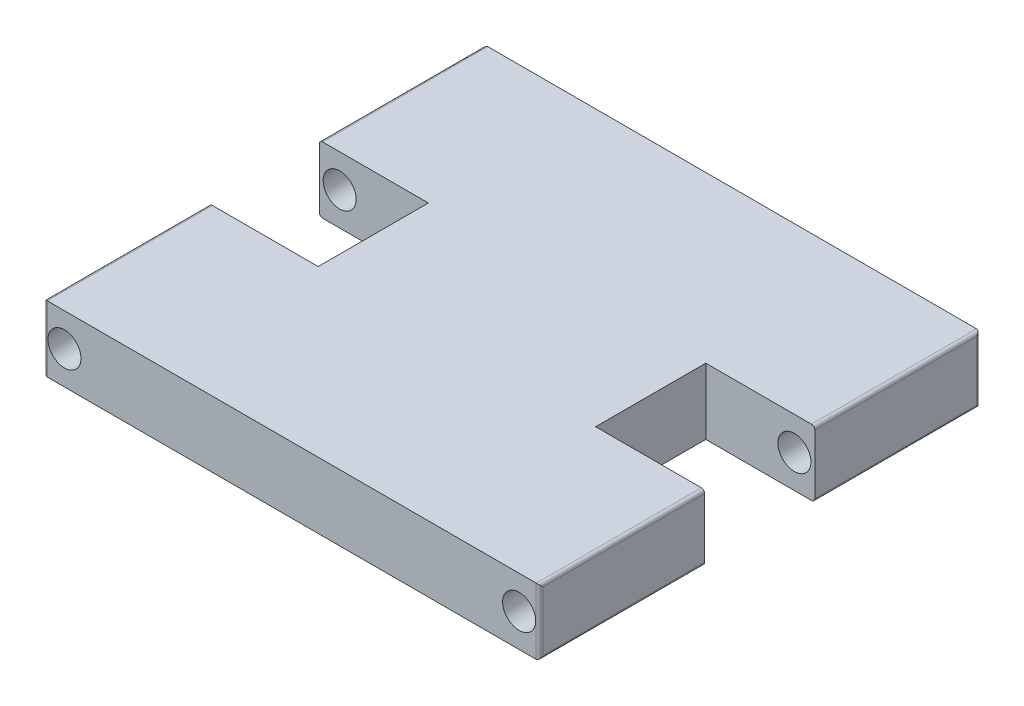
from build123d import *

# Parameters (mm, degrees)
ESTRUSIONE_ESTRUSIONE1_DEPTH  = 60
TAGLIO_ESTRUSIONE2_DEPTH      = 606.061980296
TAGLIO_ESTRUSIONE2_DEPTH_BACK = 606.061980296
SCHIZZO3_OUTSIDE_W            = 573.012
SCHIZZO3_OUTSIDE_H            = 183.012
SCHIZZO3_OUTSIDE_R            = 15
SCHIZZO4_W                    = 100
SCHIZZO4_H                    = 100
TAGLIO_ESTRUSIONE3_DEPTH      = 606.061980296


with BuildPart() as part:
    # Schizzo1 → Estrusione-Estrusione1 (new body)
    with BuildSketch(Plane(origin=(0, 0, 0), x_dir=(1, 0, 0), z_dir=(0, 1, 0))):
        with BuildLine():
            Line((3, 0), (447, 0))
            ThreePointArc((447, 0), (449.121320344, 0.878679656), (450, 3))
            Line((450, 3), (450, 397))
            ThreePointArc((450, 397), (449.121320344, 399.121320344), (447, 400))
            Line((447, 400), (3, 400))
            ThreePointArc((3, 400), (0.878679656, 399.121320344), (0, 397))
            Line((0, 397), (0, 3))
            ThreePointArc((0, 3), (0.878679656, 0.878679656), (3, 0))
        make_face()
    extrude(amount=ESTRUSIONE_ESTRUSIONE1_DEPTH)

    # Schizzo3 outside → Taglio-Estrusione2 (cut, two sides: drawn at the far end of the back side and taken through both)
    # profile 1 of 3: a face of its own
    with BuildSketch(Plane.XY.offset(-TAGLIO_ESTRUSIONE2_DEPTH_BACK)):
        with Locations((225, 30)):
            Rectangle(SCHIZZO3_OUTSIDE_W, SCHIZZO3_OUTSIDE_H)
        with BuildLine():
            Line((3, 60), (447, 60))
            ThreePointArc((447, 60), (449.121320344, 59.121320344), (450, 57))
            Line((450, 57), (450, 3))
            ThreePointArc((450, 3), (449.121320344, 0.878679656), (447, 0))
            Line((447, 0), (3, 0))
            ThreePointArc((3, 0), (0.878679656, 0.878679656), (0, 3))
            Line((0, 3), (0, 57))
            ThreePointArc((0, 57), (0.878679656, 59.121320344), (3, 60))
        make_face(mode=Mode.SUBTRACT)
    # profile 2 of 3: a face of its own
    with BuildSketch(Plane.XY.offset(-TAGLIO_ESTRUSIONE2_DEPTH_BACK)):
        with Locations((18.5, 30)):
            Circle(SCHIZZO3_OUTSIDE_R)
    # profile 3 of 3: a face of its own
    with BuildSketch(Plane.XY.offset(-TAGLIO_ESTRUSIONE2_DEPTH_BACK)):
        with Locations((431.5, 30)):
            Circle(SCHIZZO3_OUTSIDE_R)
    extrude(amount=TAGLIO_ESTRUSIONE2_DEPTH + TAGLIO_ESTRUSIONE2_DEPTH_BACK, mode=Mode.SUBTRACT)

    # Schizzo4 → Taglio-Estrusione3 (cut, through all)
    with BuildSketch(Plane(origin=(0, 0, 0), x_dir=(1, 0, 0), z_dir=(0, 1, 0))):
        with Locations((49, 200)):
            Rectangle(SCHIZZO4_W, SCHIZZO4_H)
        with Locations((401, 200)):
            Rectangle(SCHIZZO4_W, SCHIZZO4_H)
    extrude(amount=TAGLIO_ESTRUSIONE3_DEPTH, mode=Mode.SUBTRACT)


solid = part.part
